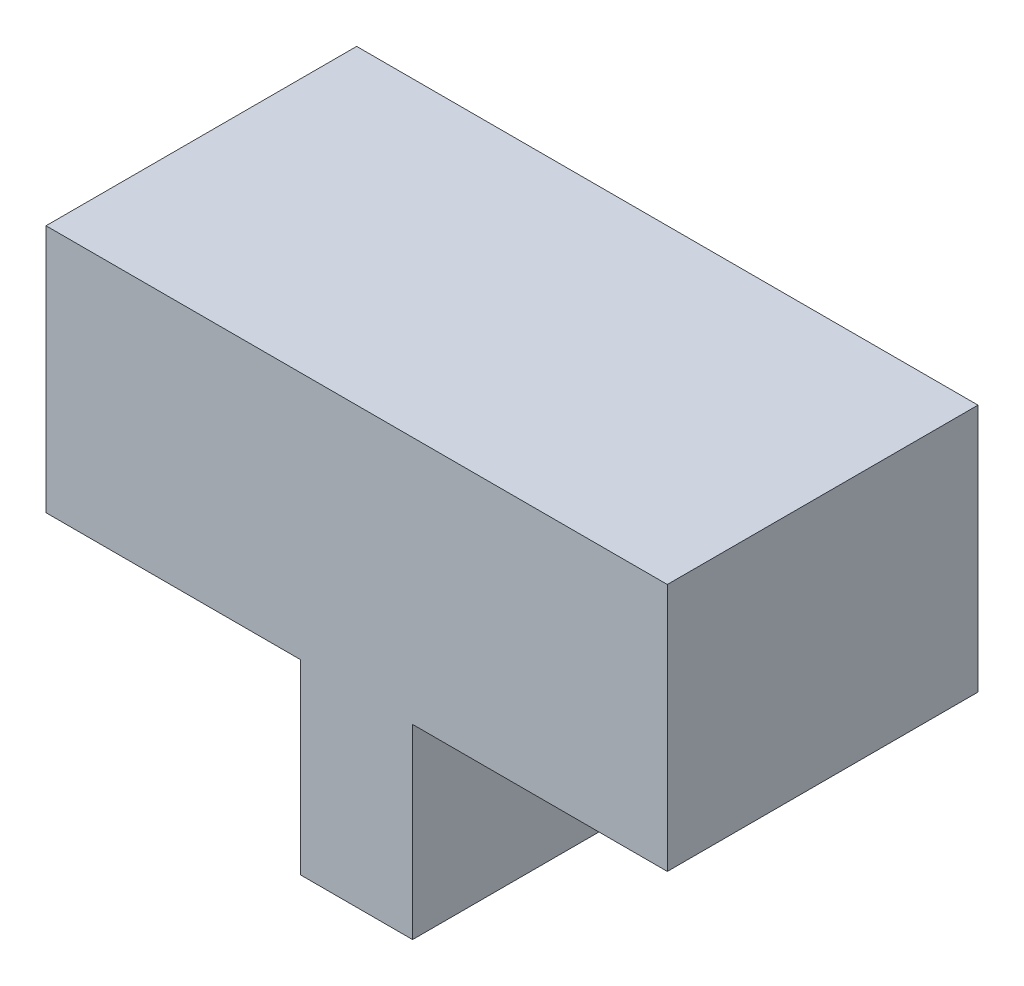
from build123d import *

# Parameters (mm, degrees)
BOSS_EXTRUDE1_DEPTH = 10


with BuildPart() as part:
    # Sketch1 → Boss-Extrude1 (new body)
    with BuildSketch(Plane.XY):
        Polygon((-1.8, 9.5), (-1.8, 3.5), (1.8, 3.5), (1.8, 9.5), (10, 9.5), (10, 17.5), (-10, 17.5), (-10, 9.5), align=None)
    extrude(amount=BOSS_EXTRUDE1_DEPTH)


solid = part.part
